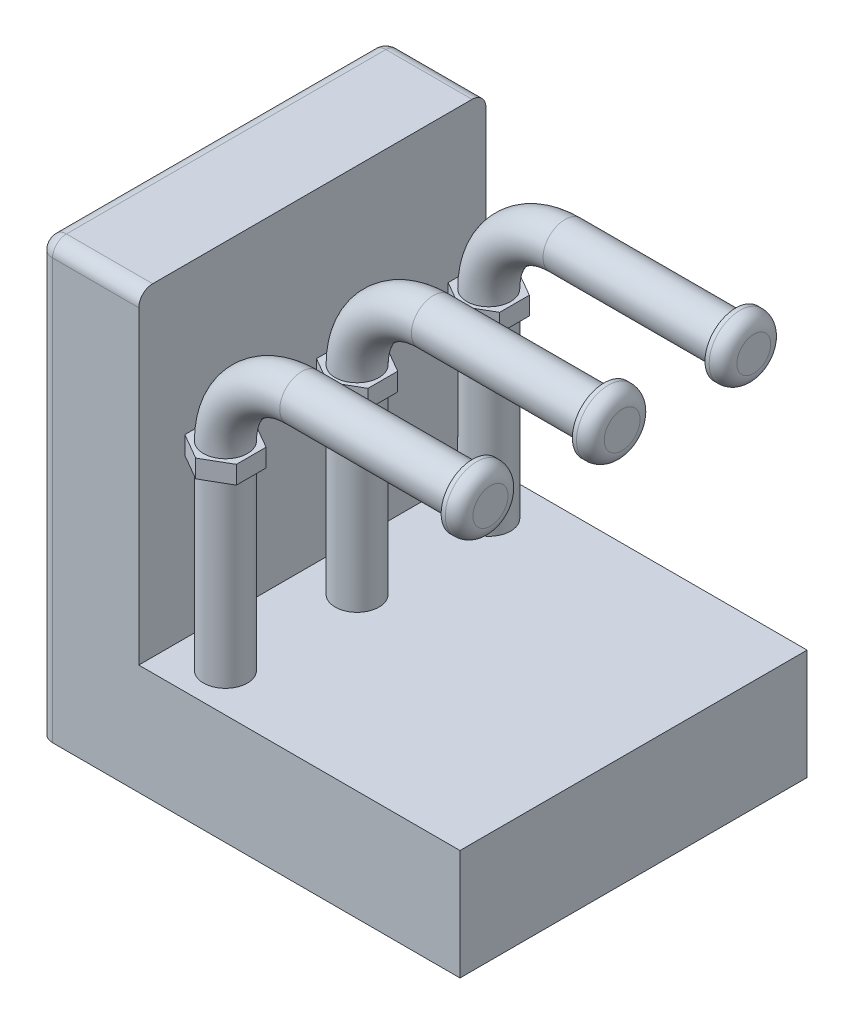
from build123d import *

# Parameters (mm, degrees)
CROQUIS1_W                = 608
CROQUIS1_H                = 501
SALIENTE_EXTRUIR1_DEPTH   = 626
CROQUIS2_W                = 463.569225487
CROQUIS2_H                = 466.634832803
CORTAR_EXTRUIR1_DEPTH     = 626
CROQUIS3_R                = 31.686095287
SALIENTE_EXTRUIR2_DEPTH   = 26
MATRIZL1_COUNT            = 3
MATRIZL1_PITCH            = 190
CROQUIS5_R                = 45.279622357
SALIENTE_EXTRUIR3_DEPTH   = 26
REDONDEO1_R               = 20
CROQUIS6_R                = 45.846999758
CROQUIS6_R_2              = 44.445641688
SALIENTE_EXTRUIR4_DEPTH   = 26
REDONDEO2_R               = 20
REDONDEO3_R               = 20
REDONDEO4_R               = 20
CROQUIS7_W                = 221.086849064
CROQUIS7_H                = 255.354139126
CORTAR_EXTRUIR2_DEPTH     = 0.01
CROQUIS8_W                = 34.3553684
CROQUIS8_H                = 34.3553684
CORTAR_EXTRUIR3_DEPTH     = 20
MATRIZL2_COUNT            = 7
MATRIZL2_PITCH            = 60
MATRIZL3_COUNT            = 4
MATRIZL3_PITCH            = 40
MATRIZL3_COPY_1_SKETCH_W  = 34.3553684
MATRIZL3_COPY_1_SKETCH_H  = 34.3553684
MATRIZL3_COPY_1_DEPTH     = 20
MATRIZL3_COPY_2_SKETCH_W  = 34.3553684
MATRIZL3_COPY_2_SKETCH_H  = 34.3553684
MATRIZL3_COPY_2_DEPTH     = 20
MATRIZL3_COPY_3_SKETCH_W  = 34.3553684
MATRIZL3_COPY_3_SKETCH_H  = 34.3553684
MATRIZL3_COPY_3_DEPTH     = 20
MATRIZL3_COPY_4_SKETCH_W  = 34.3553684
MATRIZL3_COPY_4_SKETCH_H  = 34.3553684
MATRIZL3_COPY_4_DEPTH     = 20
MATRIZL3_COPY_5_SKETCH_W  = 34.3553684
MATRIZL3_COPY_5_SKETCH_H  = 34.3553684
MATRIZL3_COPY_5_DEPTH     = 20
MATRIZL3_COPY_6_SKETCH_W  = 34.3553684
MATRIZL3_COPY_6_SKETCH_H  = 34.3553684
MATRIZL3_COPY_6_DEPTH     = 20
MATRIZL3_COPY_7_SKETCH_W  = 34.3553684
MATRIZL3_COPY_7_SKETCH_H  = 34.3553684
MATRIZL3_COPY_7_DEPTH     = 20
MATRIZL3_COPY_8_SKETCH_W  = 34.3553684
MATRIZL3_COPY_8_SKETCH_H  = 34.3553684
MATRIZL3_COPY_8_DEPTH     = 20
MATRIZL3_COPY_9_SKETCH_W  = 34.3553684
MATRIZL3_COPY_9_SKETCH_H  = 34.3553684
MATRIZL3_COPY_9_DEPTH     = 20
MATRIZL3_COPY_10_SKETCH_W = 34.3553684
MATRIZL3_COPY_10_SKETCH_H = 34.3553684
MATRIZL3_COPY_10_DEPTH    = 20
MATRIZL3_COPY_11_SKETCH_W = 34.3553684
MATRIZL3_COPY_11_SKETCH_H = 34.3553684
MATRIZL3_COPY_11_DEPTH    = 20
MATRIZL3_COPY_12_SKETCH_W = 34.3553684
MATRIZL3_COPY_12_SKETCH_H = 34.3553684
MATRIZL3_COPY_12_DEPTH    = 20
MATRIZL3_COPY_13_SKETCH_W = 34.3553684
MATRIZL3_COPY_13_SKETCH_H = 34.3553684
MATRIZL3_COPY_13_DEPTH    = 20
MATRIZL3_COPY_14_SKETCH_W = 34.3553684
MATRIZL3_COPY_14_SKETCH_H = 34.3553684
MATRIZL3_COPY_14_DEPTH    = 20
MATRIZL3_COPY_15_SKETCH_W = 34.3553684
MATRIZL3_COPY_15_SKETCH_H = 34.3553684
MATRIZL3_COPY_15_DEPTH    = 20
MATRIZL3_COPY_16_SKETCH_W = 34.3553684
MATRIZL3_COPY_16_SKETCH_H = 34.3553684
MATRIZL3_COPY_16_DEPTH    = 20
MATRIZL3_COPY_17_SKETCH_W = 34.3553684
MATRIZL3_COPY_17_SKETCH_H = 34.3553684
MATRIZL3_COPY_17_DEPTH    = 20
MATRIZL3_COPY_18_SKETCH_W = 34.3553684
MATRIZL3_COPY_18_SKETCH_H = 34.3553684
MATRIZL3_COPY_18_DEPTH    = 20


with BuildPart() as part:
    # Croquis1 → Saliente-Extruir1 (new body)
    with BuildSketch(Plane(origin=(0, 0, 0), x_dir=(1, 0, 0), z_dir=(0, 1, 0))):
        Rectangle(CROQUIS1_W, CROQUIS1_H)
    extrude(amount=SALIENTE_EXTRUIR1_DEPTH)

    # Croquis2 → Cortar-Extruir1 (cut)
    with BuildSketch(Plane.XY.offset(250.5)):
        with Locations((72.215387256, 392.682583599)):
            Rectangle(CROQUIS2_W, CROQUIS2_H)
    extrude(amount=-CORTAR_EXTRUIR1_DEPTH, mode=Mode.SUBTRACT)

    # Barrer1: sweep along a curve in space
    with BuildLine() as barrer1_path:
        Line((-90.298831374, 159.365167197, 194.686842111), (-90.298831374, 446.284479558, 194.686842111))
        ThreePointArc((-90.298831374, 446.284479558, 194.686842111), (-58.080577305, 524.066225489, 194.686842111), (19.701168626, 556.284479558, 194.686842111))
        Line((19.701168626, 556.284479558, 194.686842111), (266.21597008, 556.284479558, 194.686842111))
    # Croquis3 → Barrer1 (sweep)
    with BuildSketch(Plane(origin=(0, 159.365167197, 0), x_dir=(1, 0, 0), z_dir=(0, 1, 0))):
        with Locations((-90.298831374, -194.686842111)):
            Circle(CROQUIS3_R)
    barrer1 = sweep(path=barrer1_path.line)

    # Croquis4 → Saliente-Extruir2 (add)
    with BuildSketch(Plane(origin=(0, 446.284479558, 0), x_dir=(-1, 0, 0), z_dir=(0, -1, 0))):
        Polygon((90.298831374, -151.780850703), (53.14115284, -173.233846407), (53.14115284, -216.139837815), (90.298831374, -237.592833519), (127.456509908, -216.139837815), (127.456509908, -173.233846407), align=None)
    saliente_extruir2 = extrude(amount=SALIENTE_EXTRUIR2_DEPTH)

    # MatrizL1: Barrer1, Saliente-Extruir2 ×3
    with Locations(*[(0, 0, -i * MATRIZL1_PITCH) for i in range(1, MATRIZL1_COUNT)]):
        add(barrer1)
        add(saliente_extruir2)

    # Croquis5 → Saliente-Extruir3 (add)
    with BuildSketch(Plane(origin=(266.21597008, 0, 0), x_dir=(0, 0, -1), z_dir=(1, 0, 0))):
        with Locations(Location((-194.686842111, 556.284479558, 0), (0, 0, 180))):
            Circle(CROQUIS5_R)
    extrude(amount=SALIENTE_EXTRUIR3_DEPTH)

    # Redondeo1
    redondeo1_edges = [part.edges().sort_by_distance(p)[0] for p in [
        (292.21597008, 556.284479558, 149.407219754),
    ]]
    fillet(redondeo1_edges, radius=REDONDEO1_R)

    # Croquis6 → Saliente-Extruir4 (add)
    with BuildSketch(Plane(origin=(266.21597008, 0, 0), x_dir=(0, 0, -1), z_dir=(1, 0, 0))):
        with Locations(Location((-4.686842111, 556.284479558, 0), (0, 0, 180))):
            Circle(CROQUIS6_R)
        with Locations(Location((185.313157889, 556.284479558, 0), (0, 0, 180))):
            Circle(CROQUIS6_R_2)
    extrude(amount=SALIENTE_EXTRUIR4_DEPTH)

    # Redondeo2
    redondeo2_edges = [part.edges().sort_by_distance(p)[0] for p in [
        (292.21597008, 556.284479558, -41.160157646),
        (292.21597008, 556.284479558, -229.758799577),
    ]]
    fillet(redondeo2_edges, radius=REDONDEO2_R)

    # Redondeo3
    redondeo3_edges = [part.edges().sort_by_distance(p)[0] for p in [
        (-231.784612743, 626, 250.5),
        (-231.784612743, 626, -250.5),
    ]]
    fillet(redondeo3_edges, radius=REDONDEO3_R)

    # Redondeo4
    redondeo4_edges = [part.edges().sort_by_distance(p)[0] for p in [
        (-304, 626, 0),
        (-304, 303, 250.5),
        (-304, 303, -250.5),
        (-304, 620.142135624, 244.642135624),
        (-304, 620.142135624, -244.642135624),
    ]]
    fillet(redondeo4_edges, radius=REDONDEO4_R)

    # Croquis7 → Cortar-Extruir2 (cut)
    with BuildSketch(Plane.ZY.offset(304)):
        with Locations((0, 371.926352099)):
            Rectangle(CROQUIS7_W, CROQUIS7_H)
    extrude(amount=-CORTAR_EXTRUIR2_DEPTH, mode=Mode.SUBTRACT)

    # Croquis8 → Cortar-Extruir3 (cut)
    with BuildSketch(Plane.ZY.offset(304)):
        with Locations((-188.954526201, 202.666413023)):
            Rectangle(CROQUIS8_W, CROQUIS8_H)
    cortar_extruir3 = extrude(amount=-CORTAR_EXTRUIR3_DEPTH, mode=Mode.SUBTRACT)

    # MatrizL2: Cortar-Extruir3 ×7
    with Locations(*[(0, 0, i * MATRIZL2_PITCH) for i in range(1, MATRIZL2_COUNT)]):
        add(cortar_extruir3, mode=Mode.SUBTRACT)

    # MatrizL3: Cortar-Extruir3 ×4
    with Locations(*[(0, -i * MATRIZL3_PITCH, 0) for i in range(1, MATRIZL3_COUNT)]):
        add(cortar_extruir3, mode=Mode.SUBTRACT)

    # MatrizL3 copy 1 sketch → MatrizL3 copy 1 (cut)
    with BuildSketch(Plane(origin=(-304, -40, 60), x_dir=(0, 0, 1), z_dir=(-1, 0, 0))):
        with Locations((-188.954526201, 202.666413023)):
            Rectangle(MATRIZL3_COPY_1_SKETCH_W, MATRIZL3_COPY_1_SKETCH_H)
    extrude(amount=-MATRIZL3_COPY_1_DEPTH, mode=Mode.SUBTRACT)

    # MatrizL3 copy 2 sketch → MatrizL3 copy 2 (cut)
    with BuildSketch(Plane(origin=(-304, -80, 60), x_dir=(0, 0, 1), z_dir=(-1, 0, 0))):
        with Locations((-188.954526201, 202.666413023)):
            Rectangle(MATRIZL3_COPY_2_SKETCH_W, MATRIZL3_COPY_2_SKETCH_H)
    extrude(amount=-MATRIZL3_COPY_2_DEPTH, mode=Mode.SUBTRACT)

    # MatrizL3 copy 3 sketch → MatrizL3 copy 3 (cut)
    with BuildSketch(Plane(origin=(-304, -120, 60), x_dir=(0, 0, 1), z_dir=(-1, 0, 0))):
        with Locations((-188.954526201, 202.666413023)):
            Rectangle(MATRIZL3_COPY_3_SKETCH_W, MATRIZL3_COPY_3_SKETCH_H)
    extrude(amount=-MATRIZL3_COPY_3_DEPTH, mode=Mode.SUBTRACT)

    # MatrizL3 copy 4 sketch → MatrizL3 copy 4 (cut)
    with BuildSketch(Plane(origin=(-304, -40, 120), x_dir=(0, 0, 1), z_dir=(-1, 0, 0))):
        with Locations((-188.954526201, 202.666413023)):
            Rectangle(MATRIZL3_COPY_4_SKETCH_W, MATRIZL3_COPY_4_SKETCH_H)
    extrude(amount=-MATRIZL3_COPY_4_DEPTH, mode=Mode.SUBTRACT)

    # MatrizL3 copy 5 sketch → MatrizL3 copy 5 (cut)
    with BuildSketch(Plane(origin=(-304, -80, 120), x_dir=(0, 0, 1), z_dir=(-1, 0, 0))):
        with Locations((-188.954526201, 202.666413023)):
            Rectangle(MATRIZL3_COPY_5_SKETCH_W, MATRIZL3_COPY_5_SKETCH_H)
    extrude(amount=-MATRIZL3_COPY_5_DEPTH, mode=Mode.SUBTRACT)

    # MatrizL3 copy 6 sketch → MatrizL3 copy 6 (cut)
    with BuildSketch(Plane(origin=(-304, -120, 120), x_dir=(0, 0, 1), z_dir=(-1, 0, 0))):
        with Locations((-188.954526201, 202.666413023)):
            Rectangle(MATRIZL3_COPY_6_SKETCH_W, MATRIZL3_COPY_6_SKETCH_H)
    extrude(amount=-MATRIZL3_COPY_6_DEPTH, mode=Mode.SUBTRACT)

    # MatrizL3 copy 7 sketch → MatrizL3 copy 7 (cut)
    with BuildSketch(Plane(origin=(-304, -40, 180), x_dir=(0, 0, 1), z_dir=(-1, 0, 0))):
        with Locations((-188.954526201, 202.666413023)):
            Rectangle(MATRIZL3_COPY_7_SKETCH_W, MATRIZL3_COPY_7_SKETCH_H)
    extrude(amount=-MATRIZL3_COPY_7_DEPTH, mode=Mode.SUBTRACT)

    # MatrizL3 copy 8 sketch → MatrizL3 copy 8 (cut)
    with BuildSketch(Plane(origin=(-304, -80, 180), x_dir=(0, 0, 1), z_dir=(-1, 0, 0))):
        with Locations((-188.954526201, 202.666413023)):
            Rectangle(MATRIZL3_COPY_8_SKETCH_W, MATRIZL3_COPY_8_SKETCH_H)
    extrude(amount=-MATRIZL3_COPY_8_DEPTH, mode=Mode.SUBTRACT)

    # MatrizL3 copy 9 sketch → MatrizL3 copy 9 (cut)
    with BuildSketch(Plane(origin=(-304, -120, 180), x_dir=(0, 0, 1), z_dir=(-1, 0, 0))):
        with Locations((-188.954526201, 202.666413023)):
            Rectangle(MATRIZL3_COPY_9_SKETCH_W, MATRIZL3_COPY_9_SKETCH_H)
    extrude(amount=-MATRIZL3_COPY_9_DEPTH, mode=Mode.SUBTRACT)

    # MatrizL3 copy 10 sketch → MatrizL3 copy 10 (cut)
    with BuildSketch(Plane(origin=(-304, -40, 240), x_dir=(0, 0, 1), z_dir=(-1, 0, 0))):
        with Locations((-188.954526201, 202.666413023)):
            Rectangle(MATRIZL3_COPY_10_SKETCH_W, MATRIZL3_COPY_10_SKETCH_H)
    extrude(amount=-MATRIZL3_COPY_10_DEPTH, mode=Mode.SUBTRACT)

    # MatrizL3 copy 11 sketch → MatrizL3 copy 11 (cut)
    with BuildSketch(Plane(origin=(-304, -80, 240), x_dir=(0, 0, 1), z_dir=(-1, 0, 0))):
        with Locations((-188.954526201, 202.666413023)):
            Rectangle(MATRIZL3_COPY_11_SKETCH_W, MATRIZL3_COPY_11_SKETCH_H)
    extrude(amount=-MATRIZL3_COPY_11_DEPTH, mode=Mode.SUBTRACT)

    # MatrizL3 copy 12 sketch → MatrizL3 copy 12 (cut)
    with BuildSketch(Plane(origin=(-304, -120, 240), x_dir=(0, 0, 1), z_dir=(-1, 0, 0))):
        with Locations((-188.954526201, 202.666413023)):
            Rectangle(MATRIZL3_COPY_12_SKETCH_W, MATRIZL3_COPY_12_SKETCH_H)
    extrude(amount=-MATRIZL3_COPY_12_DEPTH, mode=Mode.SUBTRACT)

    # MatrizL3 copy 13 sketch → MatrizL3 copy 13 (cut)
    with BuildSketch(Plane(origin=(-304, -40, 300), x_dir=(0, 0, 1), z_dir=(-1, 0, 0))):
        with Locations((-188.954526201, 202.666413023)):
            Rectangle(MATRIZL3_COPY_13_SKETCH_W, MATRIZL3_COPY_13_SKETCH_H)
    extrude(amount=-MATRIZL3_COPY_13_DEPTH, mode=Mode.SUBTRACT)

    # MatrizL3 copy 14 sketch → MatrizL3 copy 14 (cut)
    with BuildSketch(Plane(origin=(-304, -80, 300), x_dir=(0, 0, 1), z_dir=(-1, 0, 0))):
        with Locations((-188.954526201, 202.666413023)):
            Rectangle(MATRIZL3_COPY_14_SKETCH_W, MATRIZL3_COPY_14_SKETCH_H)
    extrude(amount=-MATRIZL3_COPY_14_DEPTH, mode=Mode.SUBTRACT)

    # MatrizL3 copy 15 sketch → MatrizL3 copy 15 (cut)
    with BuildSketch(Plane(origin=(-304, -120, 300), x_dir=(0, 0, 1), z_dir=(-1, 0, 0))):
        with Locations((-188.954526201, 202.666413023)):
            Rectangle(MATRIZL3_COPY_15_SKETCH_W, MATRIZL3_COPY_15_SKETCH_H)
    extrude(amount=-MATRIZL3_COPY_15_DEPTH, mode=Mode.SUBTRACT)

    # MatrizL3 copy 16 sketch → MatrizL3 copy 16 (cut)
    with BuildSketch(Plane(origin=(-304, -40, 360), x_dir=(0, 0, 1), z_dir=(-1, 0, 0))):
        with Locations((-188.954526201, 202.666413023)):
            Rectangle(MATRIZL3_COPY_16_SKETCH_W, MATRIZL3_COPY_16_SKETCH_H)
    extrude(amount=-MATRIZL3_COPY_16_DEPTH, mode=Mode.SUBTRACT)

    # MatrizL3 copy 17 sketch → MatrizL3 copy 17 (cut)
    with BuildSketch(Plane(origin=(-304, -80, 360), x_dir=(0, 0, 1), z_dir=(-1, 0, 0))):
        with Locations((-188.954526201, 202.666413023)):
            Rectangle(MATRIZL3_COPY_17_SKETCH_W, MATRIZL3_COPY_17_SKETCH_H)
    extrude(amount=-MATRIZL3_COPY_17_DEPTH, mode=Mode.SUBTRACT)

    # MatrizL3 copy 18 sketch → MatrizL3 copy 18 (cut)
    with BuildSketch(Plane(origin=(-304, -120, 360), x_dir=(0, 0, 1), z_dir=(-1, 0, 0))):
        with Locations((-188.954526201, 202.666413023)):
            Rectangle(MATRIZL3_COPY_18_SKETCH_W, MATRIZL3_COPY_18_SKETCH_H)
    extrude(amount=-MATRIZL3_COPY_18_DEPTH, mode=Mode.SUBTRACT)


solid = part.part
